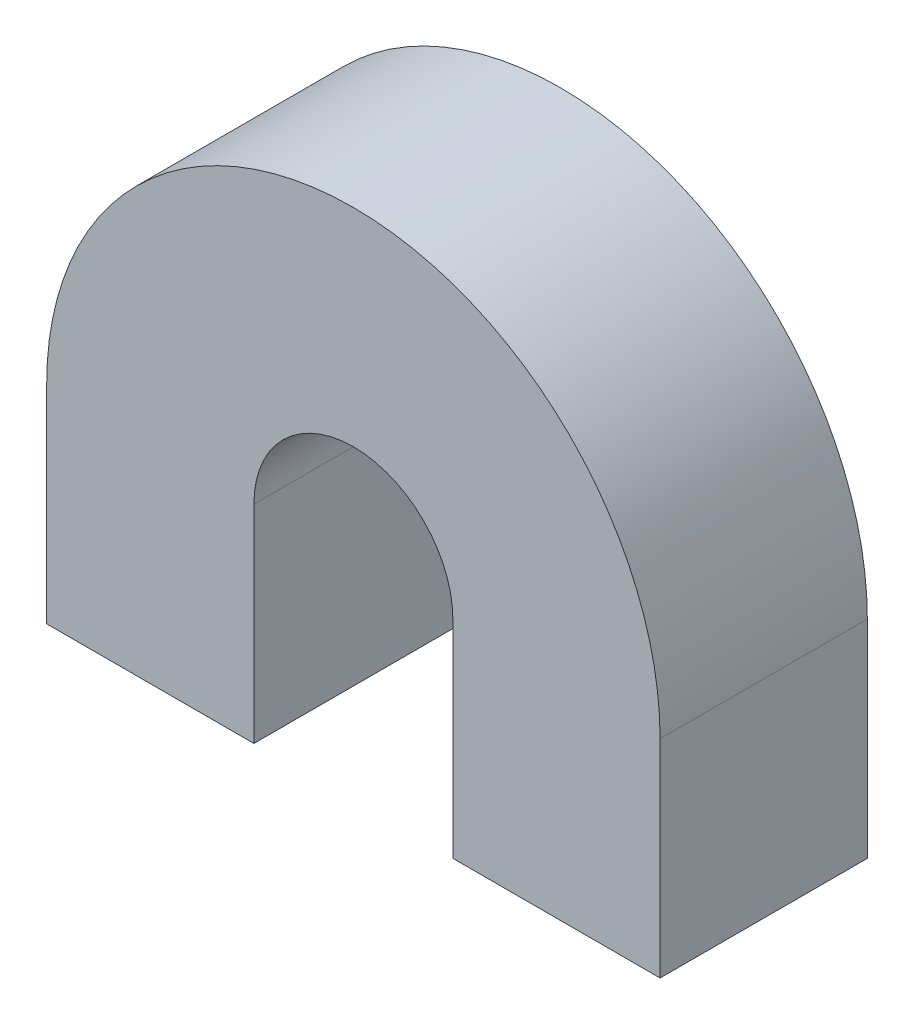
from build123d import *

# Parameters (mm, degrees)
BOSS_EXTRUDE1_DEPTH = 10


with BuildPart() as part:
    # Sketch1 → Boss-Extrude1 (new body)
    with BuildSketch(Plane.XY):
        with BuildLine():
            Line((-4.8, 8.186666667), (-4.8, 18.186666667))
            ThreePointArc((-4.8, 18.186666667), (0, 22.986666667), (4.8, 18.186666667))
            Line((4.8, 18.186666667), (4.8, 8.186666667))
            Line((4.8, 8.186666667), (14.8, 8.186666667))
            Line((14.8, 8.186666667), (14.8, 18.186666667))
            ThreePointArc((14.8, 18.186666667), (0, 32.986666667), (-14.8, 18.186666667))
            Line((-14.8, 18.186666667), (-14.8, 8.186666667))
            Line((-14.8, 8.186666667), (-4.8, 8.186666667))
        make_face()
    extrude(amount=BOSS_EXTRUDE1_DEPTH)


solid = part.part
